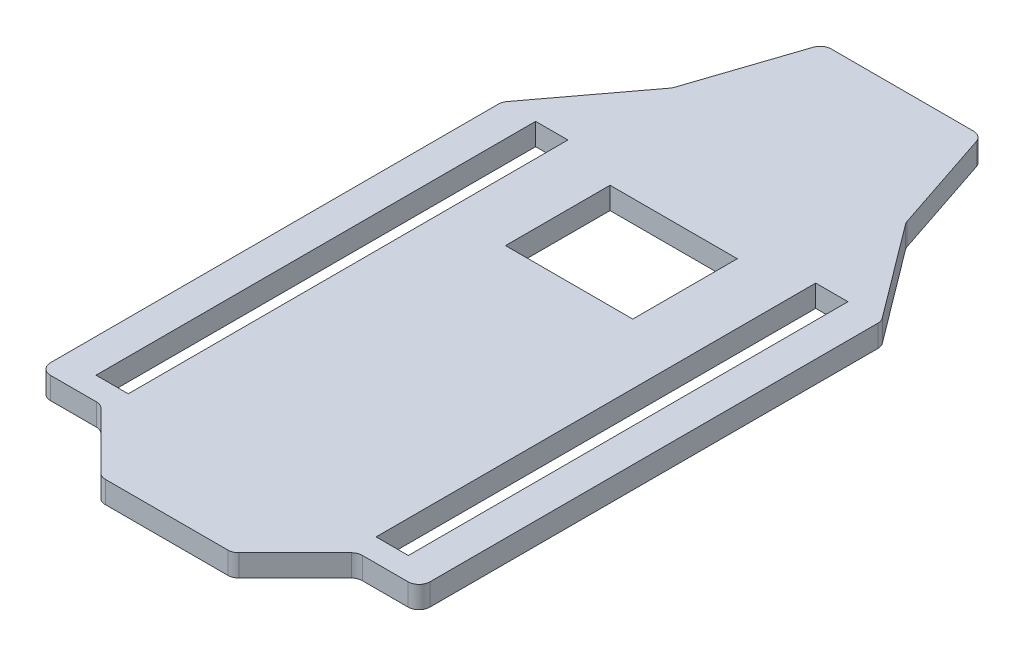
from build123d import *

# Parameters (mm, degrees)
SKETCH1_W           = 14.703470952
SKETCH1_H           = 200.333333333
SKETCH1_W_2         = 57.995054435
SKETCH1_H_2         = 47.634748305
BOSS_EXTRUDE1_DEPTH = 10


with BuildPart() as part:
    # Sketch1 → Boss-Extrude1 (new body)
    with BuildSketch(Plane(origin=(0, 0, 0), x_dir=(1, 0, 0), z_dir=(0, 1, 0))):
        with BuildLine():
            Line((0, 5), (0, 209.09430585))
            ThreePointArc((0, 209.09430585), (-0.25658351, 210.67544468), (-1, 212.09430585))
            Line((-1, 212.09430585), (-32.74341649, 254.41886117))
            ThreePointArc((-32.74341649, 254.41886117), (-33.17231305, 255.098327769), (-33.486832981, 255.83772234))
            Line((-33.486832981, 255.83772234), (-49.298221281, 303.271887242))
            ThreePointArc((-49.298221281, 303.271887242), (-51.118086348, 305.746959338), (-54.041637772, 306.690748412))
            Line((-54.041637772, 306.690748412), (-118.887294417, 306.690748412))
            ThreePointArc((-118.887294417, 306.690748412), (-121.81084584, 305.746959338), (-123.630710907, 303.271887242))
            Line((-123.630710907, 303.271887242), (-139.442099208, 255.83772234))
            ThreePointArc((-139.442099208, 255.83772234), (-139.756619138, 255.098327769), (-140.185515698, 254.41886117))
            Line((-140.185515698, 254.41886117), (-171.928932188, 212.09430585))
            ThreePointArc((-171.928932188, 212.09430585), (-172.672348678, 210.67544468), (-172.928932188, 209.09430585))
            Line((-172.928932188, 209.09430585), (-172.928932188, 5))
            ThreePointArc((-172.928932188, 5), (-171.464466094, 1.464466094), (-167.928932188, 0))
            Line((-167.928932188, 0), (-147.071067812, 0))
            ThreePointArc((-147.071067812, 0), (-145.15765065, -0.380602337), (-143.535533906, -1.464466094))
            Line((-143.535533906, -1.464466094), (-117.928932188, -27.071067812))
            ThreePointArc((-117.928932188, -27.071067812), (-116.306815444, -28.154931568), (-114.393398282, -28.535533906))
            Line((-114.393398282, -28.535533906), (-58.535533906, -28.535533906))
            ThreePointArc((-58.535533906, -28.535533906), (-56.622116744, -28.154931568), (-55, -27.071067812))
            Line((-55, -27.071067812), (-29.393398282, -1.464466094))
            ThreePointArc((-29.393398282, -1.464466094), (-27.771281538, -0.380602337), (-25.857864376, 0))
            Line((-25.857864376, 0), (-5, 0))
            ThreePointArc((-5, 0), (-1.464466094, 1.464466094), (0, 5))
        make_face()
        with Locations((-22.648264524, 110.59430585)):
            Rectangle(SKETCH1_W, SKETCH1_H, mode=Mode.SUBTRACT)
        with Locations((-150.280667664, 110.59430585)):
            Rectangle(SKETCH1_W, SKETCH1_H, mode=Mode.SUBTRACT)
        with Locations((-86.464466095, 178.682625847)):
            Rectangle(SKETCH1_W_2, SKETCH1_H_2, mode=Mode.SUBTRACT)
    extrude(amount=BOSS_EXTRUDE1_DEPTH)


solid = part.part
